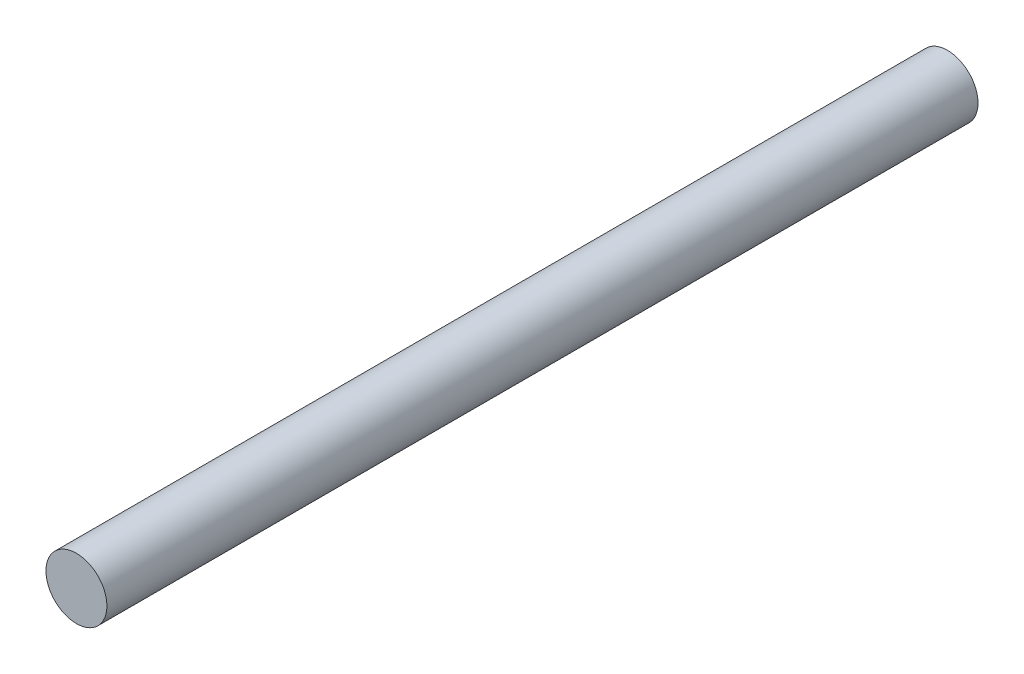
from build123d import *

# Parameters (mm, degrees)
CROQUIS1_R              = 0.63
SALIENTE_EXTRUIR1_DEPTH = 18


with BuildPart() as part:
    # Croquis1 → Saliente-Extruir1 (new body)
    with BuildSketch(Plane.XY):
        Circle(CROQUIS1_R)
    extrude(amount=SALIENTE_EXTRUIR1_DEPTH)


solid = part.part
